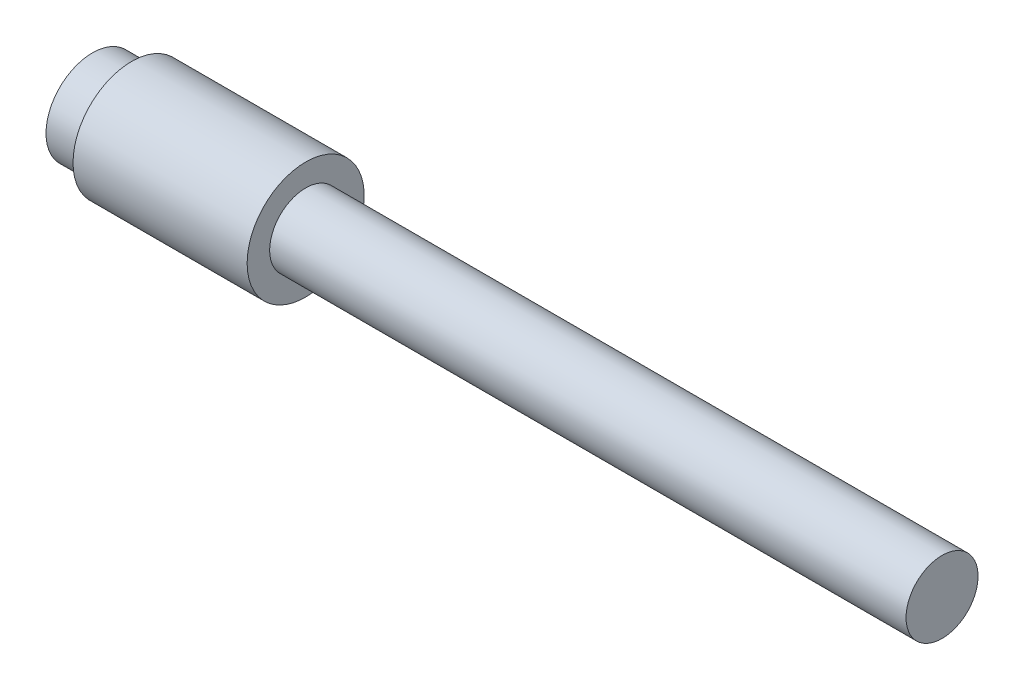
from build123d import *


with BuildPart() as part:
    # Esquisse1 → Révolution1 (revolve)
    with BuildSketch(Plane.XY, mode=Mode.PRIVATE) as r_volution1_sk:
        Polygon((0, 0), (0, 7.75), (6.5, 7.75), (6.5, 9.75), (35.5, 9.75), (35.5, 6), (141.5, 6), (141.5, 0), align=None)
    revolve(r_volution1_sk.sketch.rotate(Axis((0, 0, 0), (1, 0, 0)), 90), axis=Axis((0, 0, 0), (1, 0, 0)))


solid = part.part
